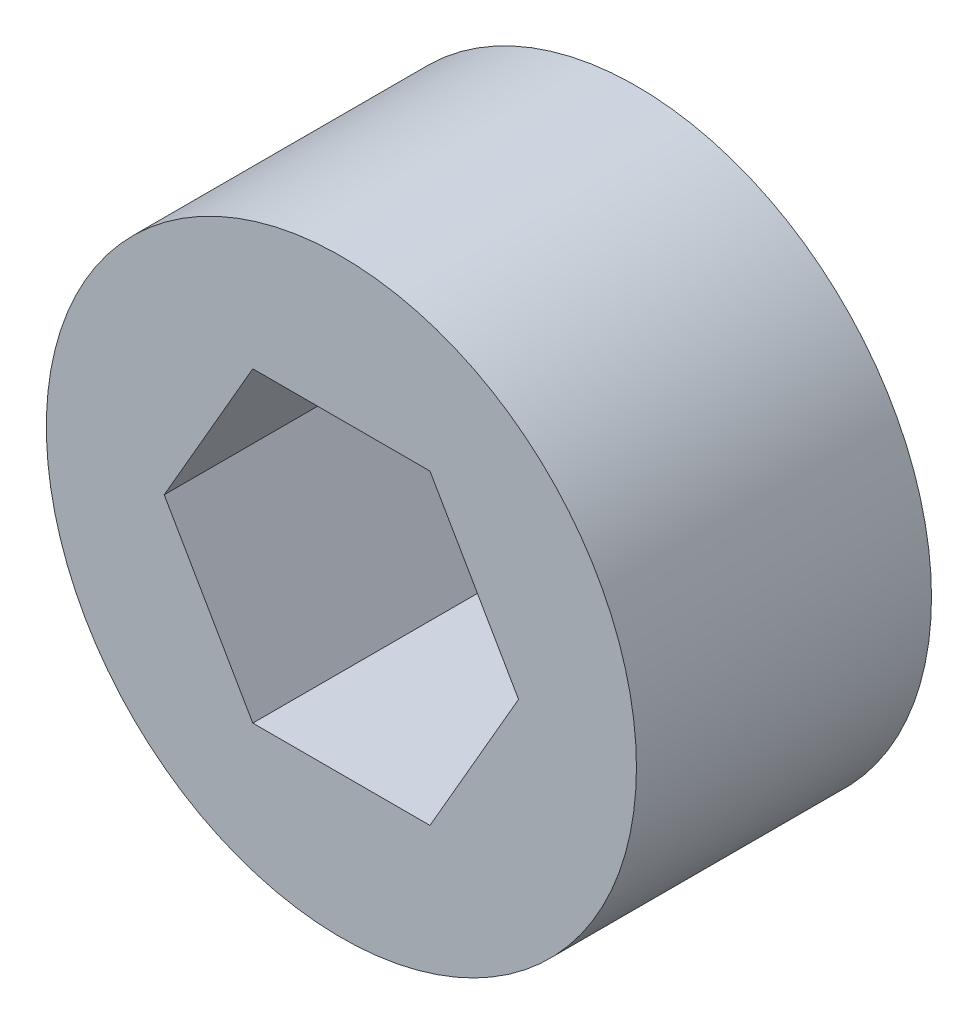
from build123d import *

# Parameters (mm, degrees)
SKETCH1_R           = 12.7
BOSS_EXTRUDE1_DEPTH = 12.7


with BuildPart() as part:
    # Sketch1 → Boss-Extrude1 (new body)
    with BuildSketch(Plane.XY):
        Circle(SKETCH1_R)
        Polygon((3.812821178, -6.604), (7.625642355, 0), (3.812821178, 6.604), (-3.812821178, 6.604), (-7.625642355, 0), (-3.812821178, -6.604), align=None, mode=Mode.SUBTRACT)
    extrude(amount=BOSS_EXTRUDE1_DEPTH)


solid = part.part
